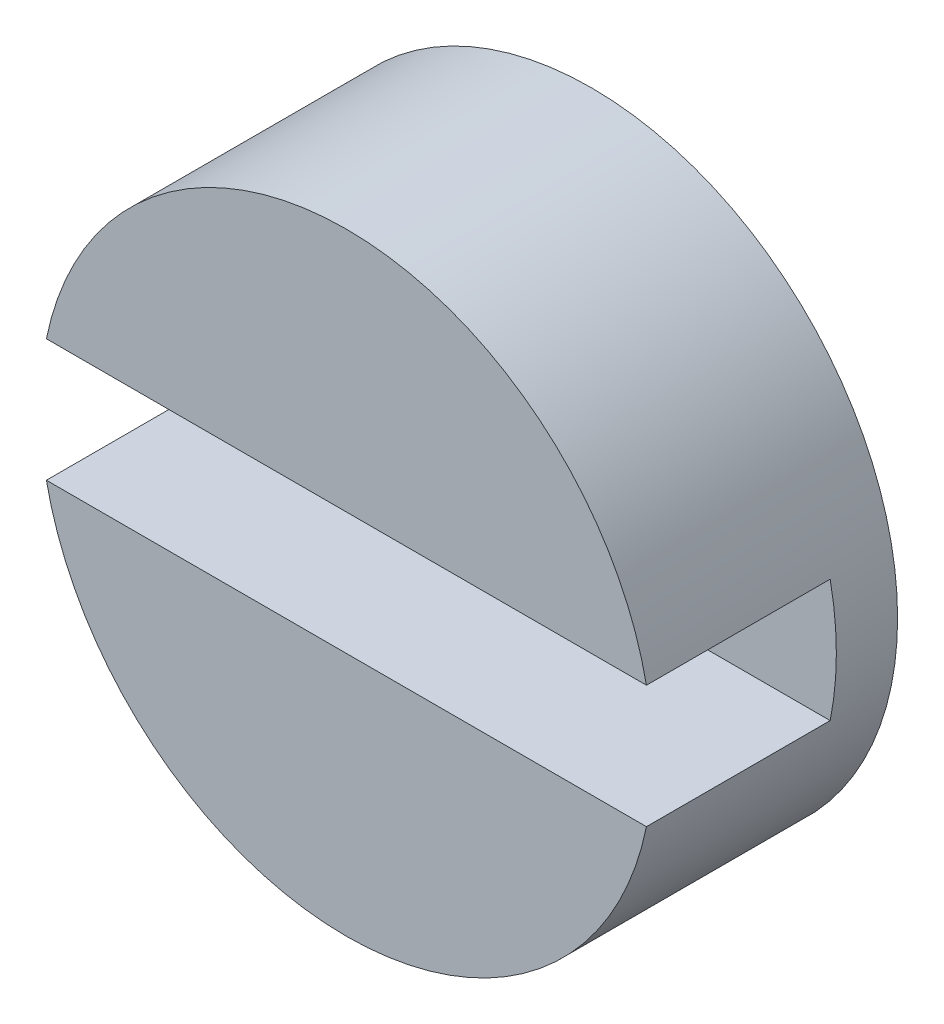
from build123d import *

# Parameters (mm, degrees)
SKETCH1_R               = 25
BOSS_EXTRUDE1_DEPTH     = 20
CUT_EXTRUDE1_DEPTH      = 41.620192023
CUT_EXTRUDE1_DEPTH_BACK = 41.620192023
SKETCH2_W               = 30
SKETCH2_H               = 10


with BuildPart() as part:
    # Sketch1 → Boss-Extrude1 (new body)
    with BuildSketch(Plane.XY):
        Circle(SKETCH1_R)
    extrude(amount=BOSS_EXTRUDE1_DEPTH)

    # Sketch2 → Cut-Extrude1 (cut, two sides: drawn at the far end of the back side and taken through both)
    with BuildSketch(Plane(origin=(0, 0, 0), x_dir=(0, 0, -1), z_dir=(1, 0, 0)).offset(-CUT_EXTRUDE1_DEPTH_BACK)):
        with Locations((-20, 0)):
            Rectangle(SKETCH2_W, SKETCH2_H)
    extrude(amount=CUT_EXTRUDE1_DEPTH + CUT_EXTRUDE1_DEPTH_BACK, mode=Mode.SUBTRACT)


solid = part.part
